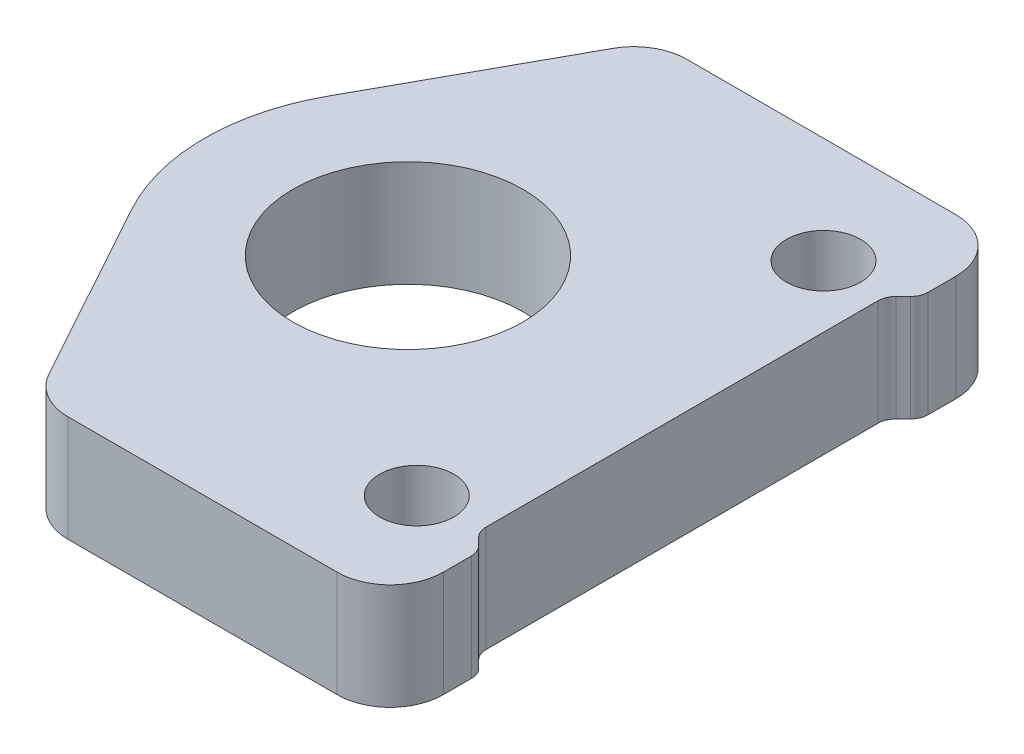
from build123d import *

# Parameters (mm, degrees)
SKETCH_1_W          = 28
SKETCH_1_H          = 35
SKETCH_1_R          = 2.1
SKETCH_1_R_2        = 6.505
EXTRUDE_1_DEPTH     = 6
CUT_EXTRUDE_1_DEPTH = 6
FILLET_1_R          = 1
CUT_EXTRUDE_2_DEPTH = 10
FILLET_2_R          = 3


with BuildPart() as part:
    # 草图1 → 凸台-拉伸1 (new body)
    with BuildSketch(Plane(origin=(0, 0, 0), x_dir=(1, 0, 0), z_dir=(0, 1, 0))):
        Rectangle(SKETCH_1_W, SKETCH_1_H)
        with Locations(Location((9.5, 11.5, 0), (0, 0, 270))):
            Circle(SKETCH_1_R, mode=Mode.SUBTRACT)
        with Locations(Location((9.5, -11.5, 0), (0, 0, 270))):
            Circle(SKETCH_1_R, mode=Mode.SUBTRACT)
        with Locations(Location((-2.5, 0, 0), (0, 0, 270))):
            Circle(SKETCH_1_R_2, mode=Mode.SUBTRACT)
    extrude(amount=EXTRUDE_1_DEPTH)

    # 草图2 → 切除-拉伸1 (cut)
    with BuildSketch(Plane(origin=(0, 6, 0), x_dir=(1, 0, 0), z_dir=(0, 1, 0))):
        Polygon((14, 12.5), (13, 11.5), (13, -11.5), (14, -12.5), align=None)
    extrude(amount=-CUT_EXTRUDE_1_DEPTH, mode=Mode.SUBTRACT)

    # 圆角1
    fillet_1_edges = [part.edges().sort_by_distance(p)[0] for p in [
        (13, 3, 11.5),
        (13, 3, -11.5),
        (14, 3, -12.5),
        (14, 3, 12.5),
    ]]
    fillet(fillet_1_edges, radius=FILLET_1_R)

    # 草图3 → 切除-拉伸2 (cut)
    with BuildSketch(Plane(origin=(0, 6, 0), x_dir=(1, 0, 0), z_dir=(0, 1, 0))):
        with BuildLine():
            Line((-14, -17.5), (-6, -17.5))
            Line((-6, -17.5), (-12.576618502, -5.541819157))
            ThreePointArc((-12.576618502, -5.541819157), (-13.638471902, -2.860846674), (-14, -2.8e-08))
            Line((-14, -2.8e-08), (-14, -17.5))
        make_face()
        with BuildLine():
            Line((-14, 17.5), (-14, -2.8e-08))
            ThreePointArc((-14, -2.8e-08), (-13.638471909, 2.860846647), (-12.576618502, 5.541819157))
            Line((-12.576618502, 5.541819157), (-6, 17.5))
            Line((-6, 17.5), (-14, 17.5))
        make_face()
    extrude(amount=-CUT_EXTRUDE_2_DEPTH, mode=Mode.SUBTRACT)

    # 圆角2
    fillet_2_edges = [part.edges().sort_by_distance(p)[0] for p in [
        (-6, 3, 17.5),
        (14, 3, 17.5),
        (14, 3, -17.5),
        (-6, 3, -17.5),
    ]]
    fillet(fillet_2_edges, radius=FILLET_2_R)


solid = part.part
